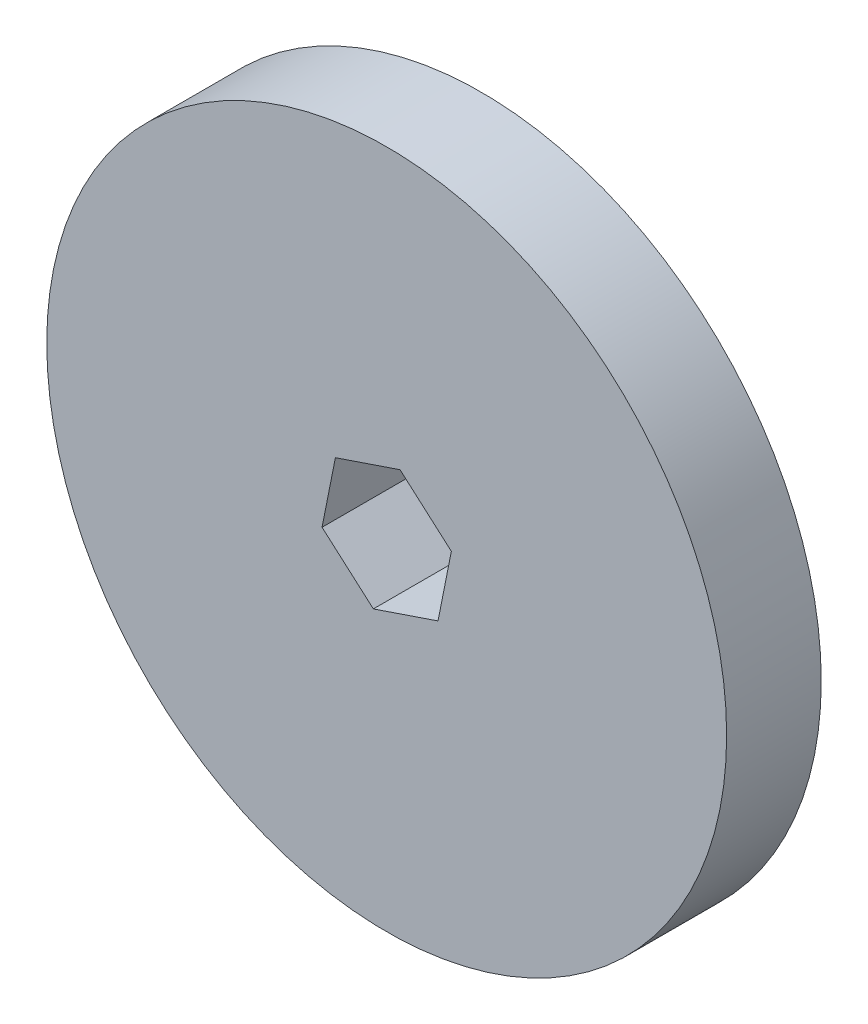
from build123d import *

# Parameters (mm, degrees)
SKETCH1_R           = 36.5125
BOSS_EXTRUDE1_DEPTH = 10.16
CUT_EXTRUDE1_DEPTH  = 53.6265229


with BuildPart() as part:
    # Sketch1 → Boss-Extrude1 (new body)
    with BuildSketch(Plane.XY):
        Circle(SKETCH1_R)
    extrude(amount=BOSS_EXTRUDE1_DEPTH)

    # Sketch2 → Cut-Extrude1 (cut, through all)
    with BuildSketch(Plane.XY.offset(10.16)):
        Polygon((6.94421261, 2.353984827), (1.433495645, 7.190856943), (-5.510716965, 4.836872116), (-6.94421261, -2.353984827), (-1.433495645, -7.190856943), (5.510716965, -4.836872116), align=None)
    extrude(amount=-CUT_EXTRUDE1_DEPTH, mode=Mode.SUBTRACT)


solid = part.part
